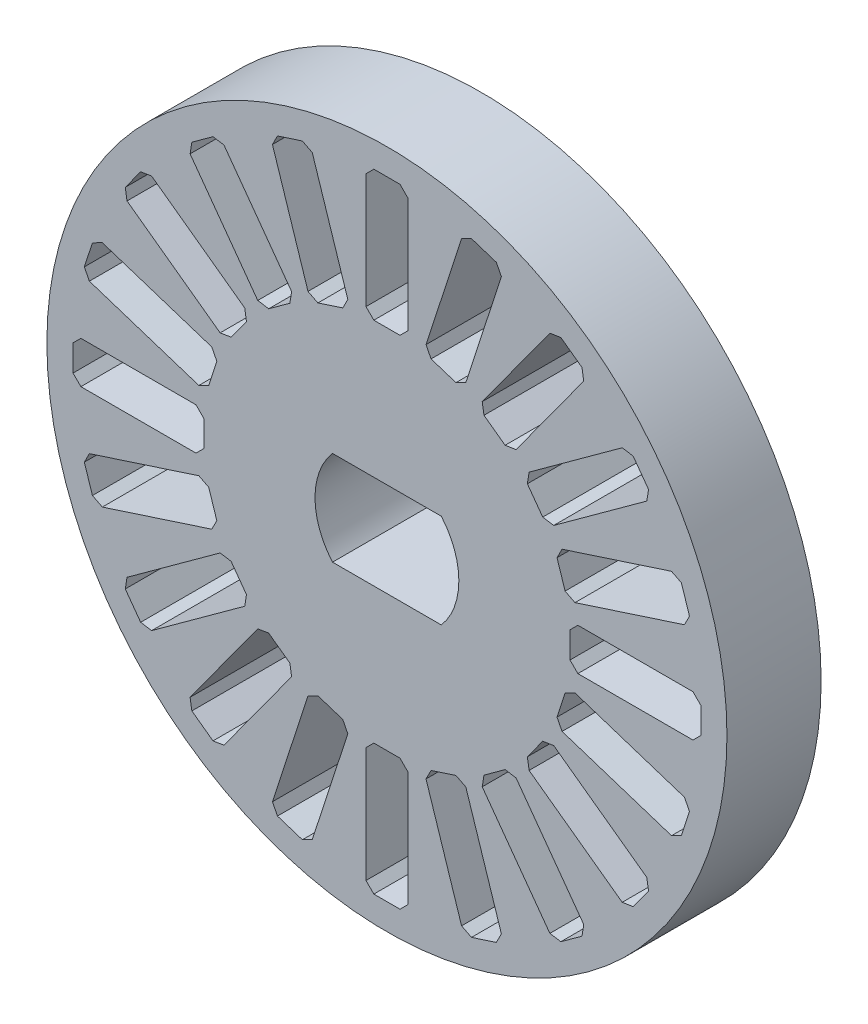
from build123d import *

# Parameters (mm, degrees)
SKETCH_1_R                           = 13
EXTRUDE_1_DEPTH                      = 3.6
SKETCH_2_W                           = 5
SKETCH_2_H                           = 1.6
CUT_EXTRUDE_2_DEPTH                  = 19.733926444
CHAMFER_1_SIZE                       = 0.3
PATTERN_CIRCULAR_1_COUNT             = 20
CHAMFER_1_OF_PATTERN_CIRCULAR_1_SIZE = 0.3


with BuildPart() as part:
    # Эскиз1 → Бобышка-Вытянуть1 (new body)
    with BuildSketch(Plane.XY):
        Circle(SKETCH_1_R)
        with BuildLine():
            Line((-2.079062289, 1.8), (2.079062289, 1.8))
            ThreePointArc((2.079062289, 1.8), (2.75, 0), (2.079062289, -1.8))
            Line((2.079062289, -1.8), (-2.079062289, -1.8))
            ThreePointArc((-2.079062289, -1.8), (-2.75, 0), (-2.079062289, 1.8))
        make_face(mode=Mode.SUBTRACT)
    extrude(amount=EXTRUDE_1_DEPTH)

    # Эскиз2 → Вырез-Вытянуть2 (cut, through all)
    with BuildSketch(Plane.XY):
        with Locations((-9.5, 0)):
            Rectangle(SKETCH_2_W, SKETCH_2_H)
    cut_extrude_2 = extrude(amount=CUT_EXTRUDE_2_DEPTH, mode=Mode.SUBTRACT)

    # Фаска1
    chamfer_1_edges = [part.edges().sort_by_distance(p)[0] for p in [
        (-7, -0.8, 1.8),
        (-7, 0.8, 1.8),
        (-12, 0.8, 1.8),
        (-12, -0.8, 1.8),
    ]]
    chamfer(chamfer_1_edges, length=CHAMFER_1_SIZE)

    # Круговой массив1: Вырез-Вытянуть2 ×20 about axis
    pattern_circular_1_axis = Axis((0, 0, -80.9), (0, 0, 1))
    for i in range(1, PATTERN_CIRCULAR_1_COUNT):
        add(cut_extrude_2.rotate(pattern_circular_1_axis, i * 360 / PATTERN_CIRCULAR_1_COUNT), mode=Mode.SUBTRACT)

    # Фаска1 of Круговой массив1
    chamfer_1_of_pattern_circular_1_edges = [part.edges().sort_by_distance(p)[0] for p in [
        (-6.410182019, -2.923964174, 1.8),
        (-6.90460921, -1.402273748, 1.8),
        (-11.659891791, -2.947358719, 1.8),
        (-11.1654646, -4.469049146, 1.8),
        (-5.192890759, -4.761710362, 1.8),
        (-6.133347162, -3.467283171, 1.8),
        (-10.178432134, -6.406209432, 1.8),
        (-9.237975731, -7.700636623, 1.8),
        (-3.467283171, -6.133347162, 1.8),
        (-4.761710362, -5.192890759, 1.8),
        (-7.700636623, -9.237975731, 1.8),
        (-6.406209432, -10.178432134, 1.8),
        (-1.402273748, -6.90460921, 1.8),
        (-2.923964174, -6.410182019, 1.8),
        (-4.469049146, -11.1654646, 1.8),
        (-2.947358719, -11.659891791, 1.8),
        (0.8, -7, 1.8),
        (-0.8, -7, 1.8),
        (-0.8, -12, 1.8),
        (0.8, -12, 1.8),
        (2.923964174, -6.410182019, 1.8),
        (1.402273748, -6.90460921, 1.8),
        (2.947358719, -11.659891791, 1.8),
        (4.469049146, -11.1654646, 1.8),
        (4.761710362, -5.192890759, 1.8),
        (3.467283171, -6.133347162, 1.8),
        (6.406209432, -10.178432134, 1.8),
        (7.700636623, -9.237975731, 1.8),
        (6.133347162, -3.467283171, 1.8),
        (5.192890759, -4.761710362, 1.8),
        (9.237975731, -7.700636623, 1.8),
        (10.178432134, -6.406209432, 1.8),
        (6.90460921, -1.402273748, 1.8),
        (6.410182019, -2.923964174, 1.8),
        (11.1654646, -4.469049146, 1.8),
        (11.659891791, -2.947358719, 1.8),
        (7, 0.8, 1.8),
        (7, -0.8, 1.8),
        (12, -0.8, 1.8),
        (12, 0.8, 1.8),
        (6.410182019, 2.923964174, 1.8),
        (6.90460921, 1.402273748, 1.8),
        (11.659891791, 2.947358719, 1.8),
        (11.1654646, 4.469049146, 1.8),
        (5.192890759, 4.761710362, 1.8),
        (6.133347162, 3.467283171, 1.8),
        (10.178432134, 6.406209432, 1.8),
        (9.237975731, 7.700636623, 1.8),
        (3.467283171, 6.133347162, 1.8),
        (4.761710362, 5.192890759, 1.8),
        (7.700636623, 9.237975731, 1.8),
        (6.406209432, 10.178432134, 1.8),
        (1.402273748, 6.90460921, 1.8),
        (2.923964174, 6.410182019, 1.8),
        (4.469049146, 11.1654646, 1.8),
        (2.947358719, 11.659891791, 1.8),
        (-0.8, 7, 1.8),
        (0.8, 7, 1.8),
        (0.8, 12, 1.8),
        (-0.8, 12, 1.8),
        (-2.923964174, 6.410182019, 1.8),
        (-1.402273748, 6.90460921, 1.8),
        (-2.947358719, 11.659891791, 1.8),
        (-4.469049146, 11.1654646, 1.8),
        (-4.761710362, 5.192890759, 1.8),
        (-3.467283171, 6.133347162, 1.8),
        (-6.406209432, 10.178432134, 1.8),
        (-7.700636623, 9.237975731, 1.8),
        (-6.133347162, 3.467283171, 1.8),
        (-5.192890759, 4.761710362, 1.8),
        (-9.237975731, 7.700636623, 1.8),
        (-10.178432134, 6.406209432, 1.8),
        (-6.90460921, 1.402273748, 1.8),
        (-6.410182019, 2.923964174, 1.8),
        (-11.1654646, 4.469049146, 1.8),
        (-11.659891791, 2.947358719, 1.8),
    ]]
    chamfer(chamfer_1_of_pattern_circular_1_edges, length=CHAMFER_1_OF_PATTERN_CIRCULAR_1_SIZE)


solid = part.part
